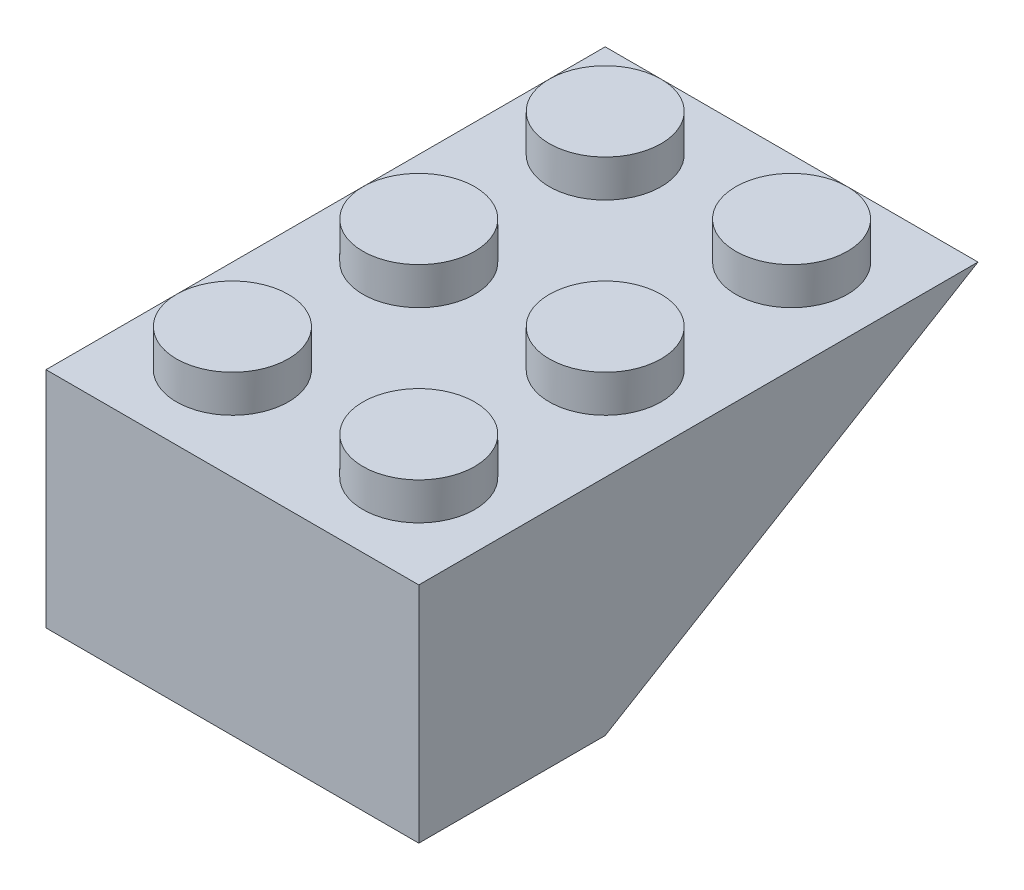
from build123d import *

# Parameters (mm, degrees)
SKETCH1_W            = 16
SKETCH1_H            = 8
BOSS_EXTRUDE1_DEPTH  = 9.6
SHELL1_T             = -1.6
BOSS_EXTRUDE3_DEPTH  = 16
SKETCH2_R            = 2.4
BOSS_EXTRUDE2_DEPTH  = 1.6
LPATTERN1_COUNT      = 2
LPATTERN1_PITCH      = 8
LPATTERN1_COUNT_DIR2 = 3
LPATTERN1_PITCH_DIR2 = 8


with BuildPart() as part:
    # Sketch1 → Boss-Extrude1 (new body)
    with BuildSketch(Plane(origin=(0, 0, 0), x_dir=(1, 0, 0), z_dir=(0, 1, 0))):
        with Locations((8, 4)):
            Rectangle(SKETCH1_W, SKETCH1_H)
    extrude(amount=BOSS_EXTRUDE1_DEPTH)

    # Shell1
    shell1_openings = [part.faces().sort_by_distance(p)[0] for p in [
        (8, 0, -4),
    ]]
    offset(amount=SHELL1_T, openings=shell1_openings, kind=Kind.INTERSECTION)

    # Sketch3 → Boss-Extrude3 (add)
    with BuildSketch(Plane(origin=(16, 0, 0), x_dir=(0, 0, -1), z_dir=(1, 0, 0))):
        Polygon((8, 0), (24, 9.6), (8, 9.6), align=None)
    extrude(amount=-BOSS_EXTRUDE3_DEPTH)

    # Sketch2 → Boss-Extrude2 (add)
    with BuildSketch(Plane(origin=(0, 9.6, 0), x_dir=(1, 0, 0), z_dir=(0, 1, 0))):
        with Locations(Location((12, 4, 0), (0, 0, 90))):
            Circle(SKETCH2_R)
    boss_extrude2 = extrude(amount=BOSS_EXTRUDE2_DEPTH)

    # LPattern1: Boss-Extrude2 2 × 3
    with Locations(*[(-i * LPATTERN1_PITCH, 0, -j * LPATTERN1_PITCH_DIR2) for i in range(LPATTERN1_COUNT) for j in range(LPATTERN1_COUNT_DIR2) if (i, j) != (0, 0)]):
        add(boss_extrude2)


solid = part.part
